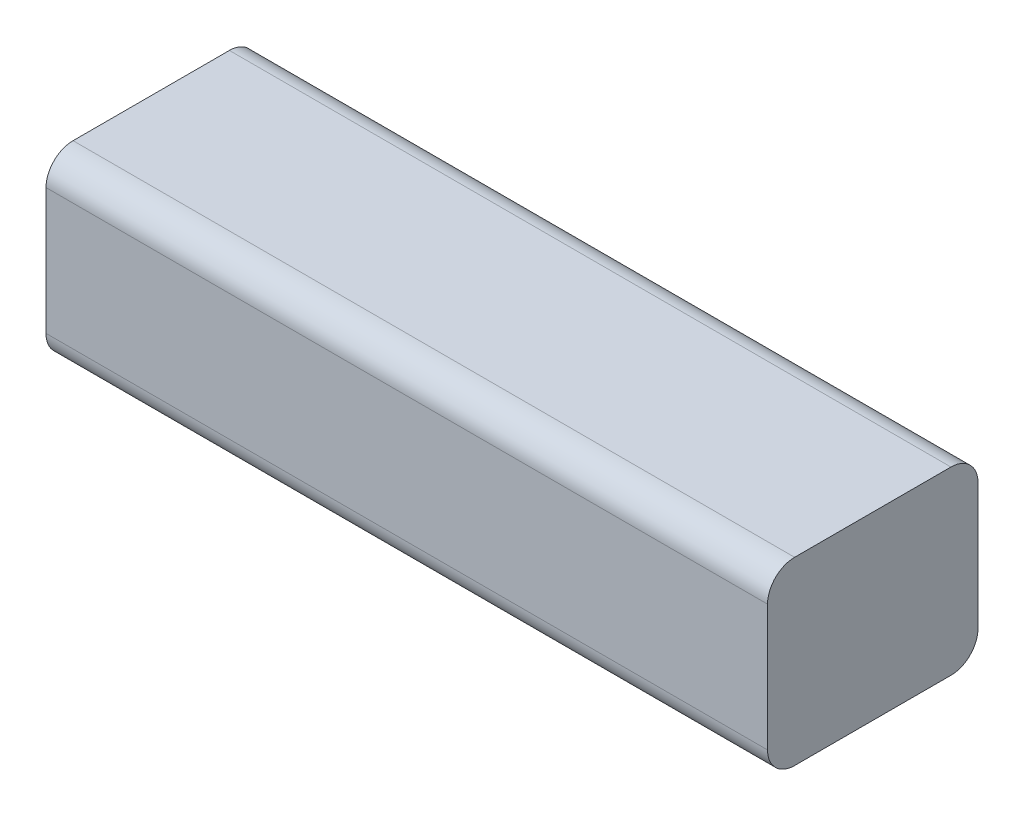
from build123d import *

# Parameters (mm, degrees)
SKETCH1_W           = 120
SKETCH1_H           = 30
BOSS_EXTRUDE2_DEPTH = 35
FILLET2_R           = 4.5


with BuildPart() as part:
    # Sketch1 → Boss-Extrude2 (new body)
    with BuildSketch(Plane.XY):
        with Locations((60, 15)):
            Rectangle(SKETCH1_W, SKETCH1_H)
    extrude(amount=BOSS_EXTRUDE2_DEPTH)

    # Fillet2
    fillet2_edges = [part.edges().sort_by_distance(p)[0] for p in [
        (60, 30, 35),
        (60, 0, 35),
        (60, 30, 0),
        (60, 0, 0),
    ]]
    fillet(fillet2_edges, radius=FILLET2_R)


solid = part.part
